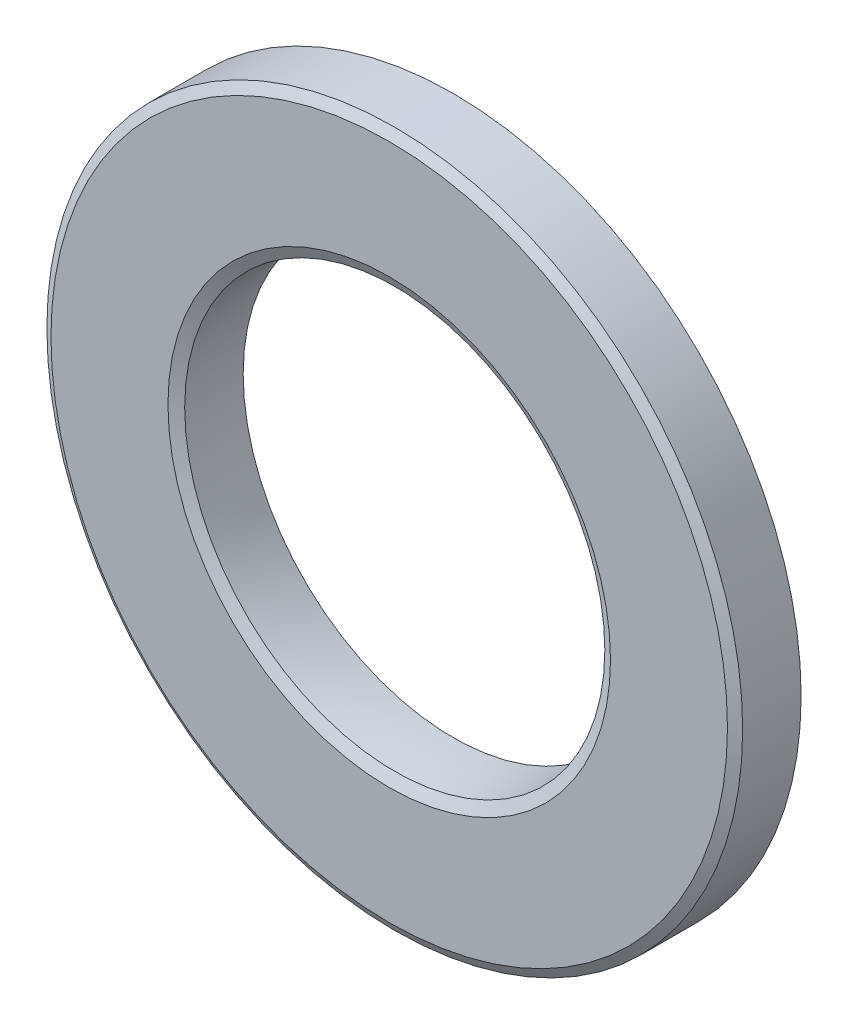
from build123d import *
from OCP.BRepFilletAPI import BRepFilletAPI_MakeChamfer

# Parameters (mm, degrees)
BOSS_EXTRUDE1_DEPTH      = 1.5875
BOSS_EXTRUDE1_DEPTH_BACK = 1.5875
SKETCH3_R                = 15.875
SKETCH3_R_2              = 9.5504
CHAMFER1_SIZE            = 0.254
CHAMFER1_SIZE2           = 0.439940905
CHAMFER2_SIZE            = 0.254
CHAMFER2_SIZE2           = 0.495866606


with BuildPart() as part:
    # Sketch3 → Boss-Extrude1 (new, two sides: drawn at the far end of the back side and taken through both)
    with BuildSketch(Plane.XY.offset(-BOSS_EXTRUDE1_DEPTH_BACK)):
        with Locations(Location((0, 0, 0), (0, 0, 180))):
            Circle(SKETCH3_R)
        with Locations(Location((0, 0, 0), (0, 0, 180))):
            Circle(SKETCH3_R_2, mode=Mode.SUBTRACT)
    extrude(amount=BOSS_EXTRUDE1_DEPTH + BOSS_EXTRUDE1_DEPTH_BACK)

    # Chamfer1: one chamfer whose edges measure the first distance from different faces: ONE call of the kernel's chamfer builder (chamfer() names one face for all edges)
    chamfer1_edges_1 = [part.edges().sort_by_distance(p)[0] for p in [
        (15.875, 0, 1.5875),
    ]]
    chamfer1_side_1 = [part.faces().sort_by_distance(p)[0] for p in [
        (15.875, 0, 0.79375),
    ]]
    chamfer1_edges_2 = [part.edges().sort_by_distance(p)[0] for p in [
        (15.875, 0, -1.5875),
    ]]
    chamfer1_side_2 = [part.faces().sort_by_distance(p)[0] for p in [
        (15.875, 0, -0.79375),
    ]]
    chamfer1 = BRepFilletAPI_MakeChamfer(part.part.solid().wrapped)
    for e in chamfer1_edges_1:
        chamfer1.Add(CHAMFER1_SIZE, CHAMFER1_SIZE2, e.wrapped, chamfer1_side_1[0].wrapped)  # the first distance lies on this face
    for e in chamfer1_edges_2:
        chamfer1.Add(CHAMFER1_SIZE, CHAMFER1_SIZE2, e.wrapped, chamfer1_side_2[0].wrapped)  # the first distance lies on this face
    add(Compound.cast(chamfer1.Shape()), mode=Mode.REPLACE)

    # Sketch4 → Cut-Revolve1 (revolve, cut)
    with BuildSketch(Plane(origin=(0, 0, 0), x_dir=(0, 0, -1), z_dir=(1, 0, 0)), mode=Mode.PRIVATE) as cut_revolve1_sk:
        with BuildLine():
            Line((-1.5875, 9.4996), (-1.5875, 9.6012))
            ThreePointArc((-1.5875, 9.6012), (0, 9.5504), (1.5875, 9.6012))
            Line((1.5875, 9.6012), (1.5875, 9.4996))
            Line((1.5875, 9.4996), (-1.5875, 9.4996))
        make_face()
    revolve(cut_revolve1_sk.sketch.rotate(Axis((0, 0, 1.5875), (0, 0, -1)), 180), axis=Axis((0, 0, 1.5875), (0, 0, -1)), mode=Mode.SUBTRACT)

    # Chamfer2: one chamfer whose edges measure the first distance from different faces: ONE call of the kernel's chamfer builder (chamfer() names one face for all edges)
    chamfer2_edges_1 = [part.edges().sort_by_distance(p)[0] for p in [
        (0, 9.6012, -1.5875),
    ]]
    chamfer2_side_1 = [part.faces().sort_by_distance(p)[0] for p in [
        (0, 9.56310325, -0.794156296),
    ]]
    chamfer2_edges_2 = [part.edges().sort_by_distance(p)[0] for p in [
        (0, 9.6012, 1.5875),
    ]]
    chamfer2_side_2 = [part.faces().sort_by_distance(p)[0] for p in [
        (0, 9.56310325, 0.794156296),
    ]]
    chamfer2 = BRepFilletAPI_MakeChamfer(part.part.solid().wrapped)
    for e in chamfer2_edges_1:
        chamfer2.Add(CHAMFER2_SIZE, CHAMFER2_SIZE2, e.wrapped, chamfer2_side_1[0].wrapped)  # the first distance lies on this face
    for e in chamfer2_edges_2:
        chamfer2.Add(CHAMFER2_SIZE, CHAMFER2_SIZE2, e.wrapped, chamfer2_side_2[0].wrapped)  # the first distance lies on this face
    add(Compound.cast(chamfer2.Shape()), mode=Mode.REPLACE)


solid = part.part
